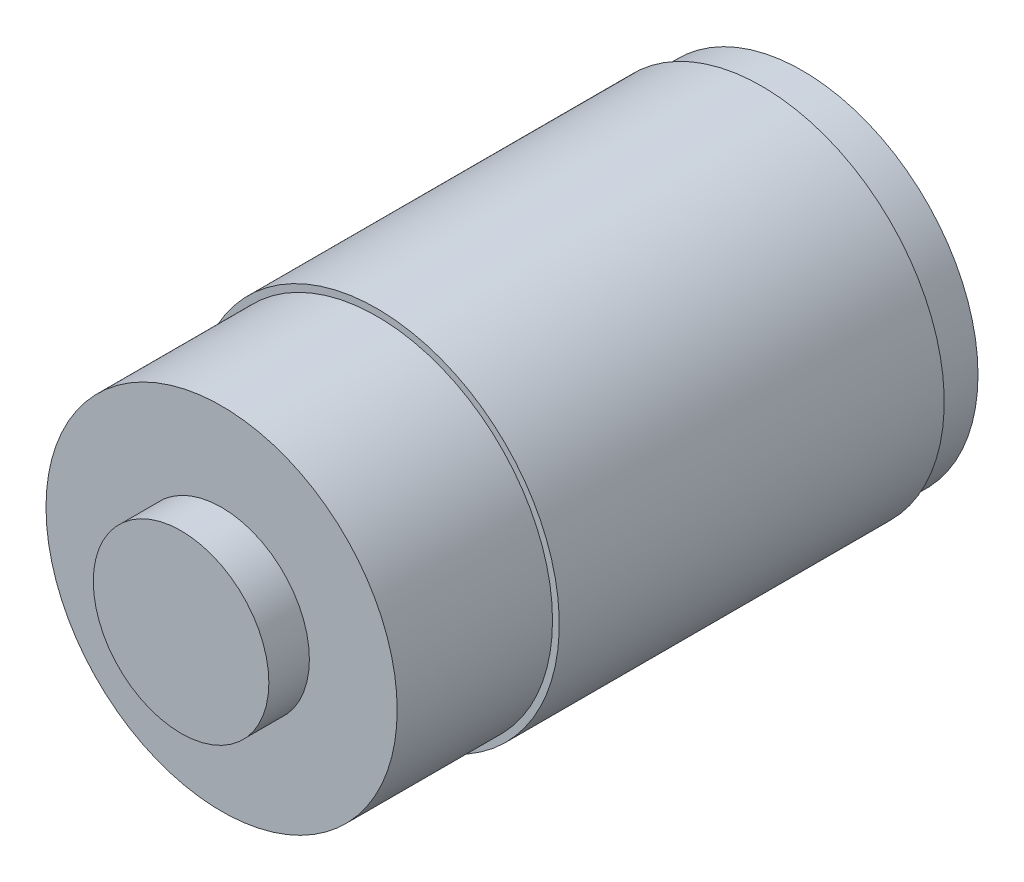
from build123d import *

# Parameters (mm, degrees)
SKETCH1_R           = 27
BOSS_EXTRUDE1_DEPTH = 57
SKETCH2_R           = 26
BOSS_EXTRUDE2_DEPTH = 23
SKETCH3_R           = 13
BOSS_EXTRUDE3_DEPTH = 6
BOSS_EXTRUDE4_START = 6
SKETCH4_R           = 26
BOSS_EXTRUDE4_DEPTH = 6


with BuildPart() as part:
    # Sketch1 → Boss-Extrude1 (new body)
    with BuildSketch(Plane.XY):
        with Locations(Location((0, 0, 0), (0, 0, 180))):
            Circle(SKETCH1_R)
    extrude(amount=BOSS_EXTRUDE1_DEPTH)

    # Sketch2 → Boss-Extrude2 (add)
    with BuildSketch(Plane.XY.offset(57)):
        Circle(SKETCH2_R)
    extrude(amount=BOSS_EXTRUDE2_DEPTH)

    # Sketch3 → Boss-Extrude3 (add)
    with BuildSketch(Plane.XY.offset(80)):
        Circle(SKETCH3_R)
    extrude(amount=BOSS_EXTRUDE3_DEPTH)

    # Sketch4 → Boss-Extrude4 (add)
    with BuildSketch(Plane(origin=(0, 0, 0), x_dir=(-1, 0, 0), z_dir=(0, 0, -1)).offset(BOSS_EXTRUDE4_START)):
        with Locations(Location((0, 0, 0), (0, 0, 180))):
            Circle(SKETCH4_R)
    extrude(amount=-BOSS_EXTRUDE4_DEPTH)


solid = part.part
